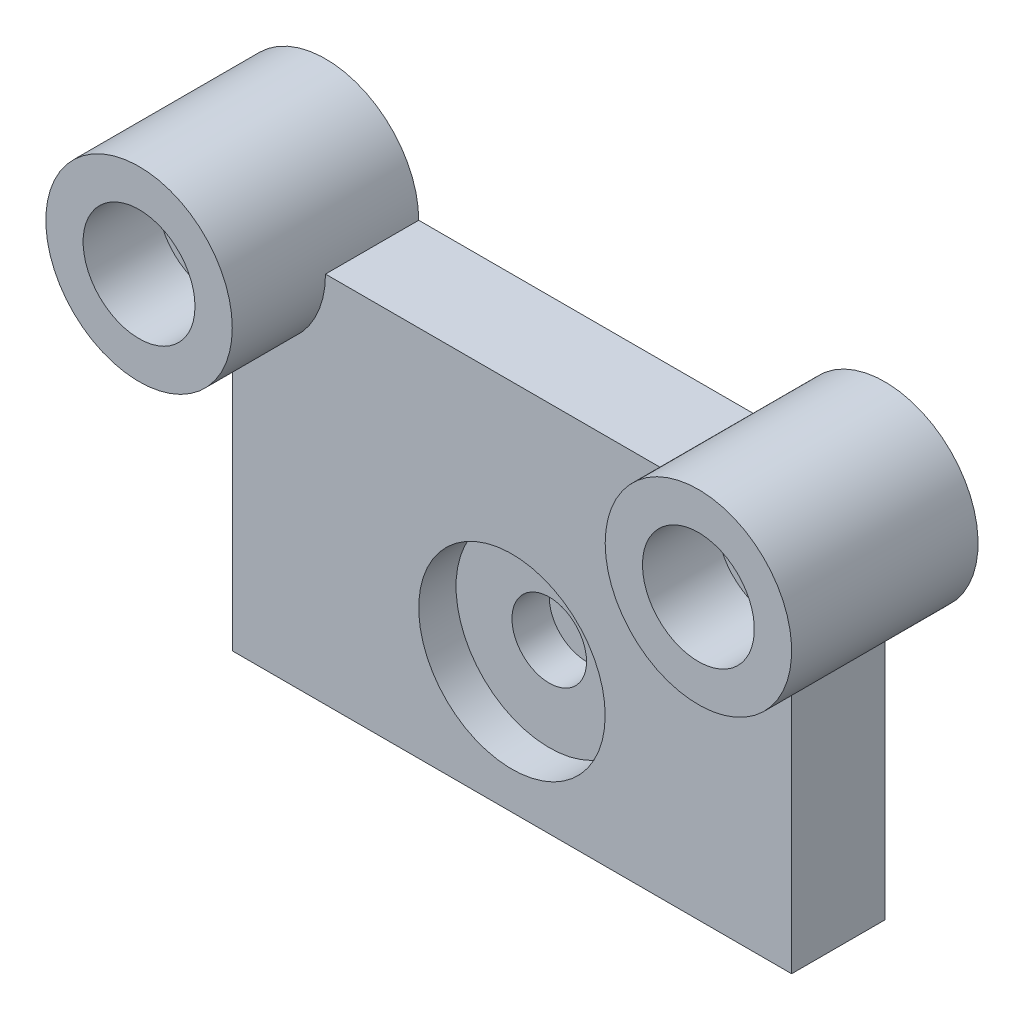
from build123d import *

# Parameters (mm, degrees)
SKETCH_1_W          = 150
SKETCH_1_H          = 100
EXTRUDE_1_DEPTH     = 25
SKETCH_2_R          = 25
EXTRUDE_2_DEPTH     = 25
SKETCH_3_R          = 15
CUT_EXTRUDE_1_DEPTH = 20
SKETCH_4_R          = 7.5
CUT_EXTRUDE_2_DEPTH = 15
CUT_EXTRUDE_3_DEPTH = 10
SKETCH_6_R          = 10
CUT_EXTRUDE_4_DEPTH = 10


with BuildPart() as part:
    # Эскиз1 → Бобышка-Вытянуть1 (new body)
    with BuildSketch(Plane.XY):
        with Locations((75, -50)):
            Rectangle(SKETCH_1_W, SKETCH_1_H)
    extrude(amount=EXTRUDE_1_DEPTH)

    # Эскиз2 → Бобышка-Вытянуть2 (add, symmetric)
    with BuildSketch(Plane.XY.offset(25)):
        Circle(SKETCH_2_R)
        with Locations(Location((150, 0, 0), (0, 0, 180))):
            Circle(SKETCH_2_R)
    extrude(amount=EXTRUDE_2_DEPTH, both=True)

    # Эскиз3 → Вырез-Вытянуть1 (cut)
    with BuildSketch(Plane.XY.offset(50)):
        Circle(SKETCH_3_R)
        with Locations(Location((150, 0, 0), (0, 0, 180))):
            Circle(SKETCH_3_R)
    extrude(amount=-CUT_EXTRUDE_1_DEPTH, mode=Mode.SUBTRACT)

    # Эскиз4 → Вырез-Вытянуть2 (cut)
    with BuildSketch(Plane.XY.offset(30)):
        Circle(SKETCH_4_R)
        with Locations(Location((150, 0, 0), (0, 0, 180))):
            Circle(SKETCH_4_R)
    extrude(amount=-CUT_EXTRUDE_2_DEPTH, mode=Mode.SUBTRACT)

    # Эскиз5 → Вырез-Вытянуть3 (cut)
    with BuildSketch(Plane.XY.offset(25)):
        with BuildLine():
            ThreePointArc((100, -65), (92.67766953, -47.32233047), (75, -40))
            Line((75, -40), (75, -90))
            ThreePointArc((75, -90), (92.67766953, -82.67766953), (100, -65))
        make_face()
        with BuildLine():
            Line((75, -90), (75, -40))
            ThreePointArc((75, -40), (50, -65), (75, -90))
        make_face()
    extrude(amount=-CUT_EXTRUDE_3_DEPTH, mode=Mode.SUBTRACT)

    # Эскиз6 → Вырез-Вытянуть4 (cut)
    with BuildSketch(Plane.XY.offset(15)):
        with Locations((75, -65)):
            Circle(SKETCH_6_R)
    extrude(amount=-CUT_EXTRUDE_4_DEPTH, mode=Mode.SUBTRACT)


solid = part.part
